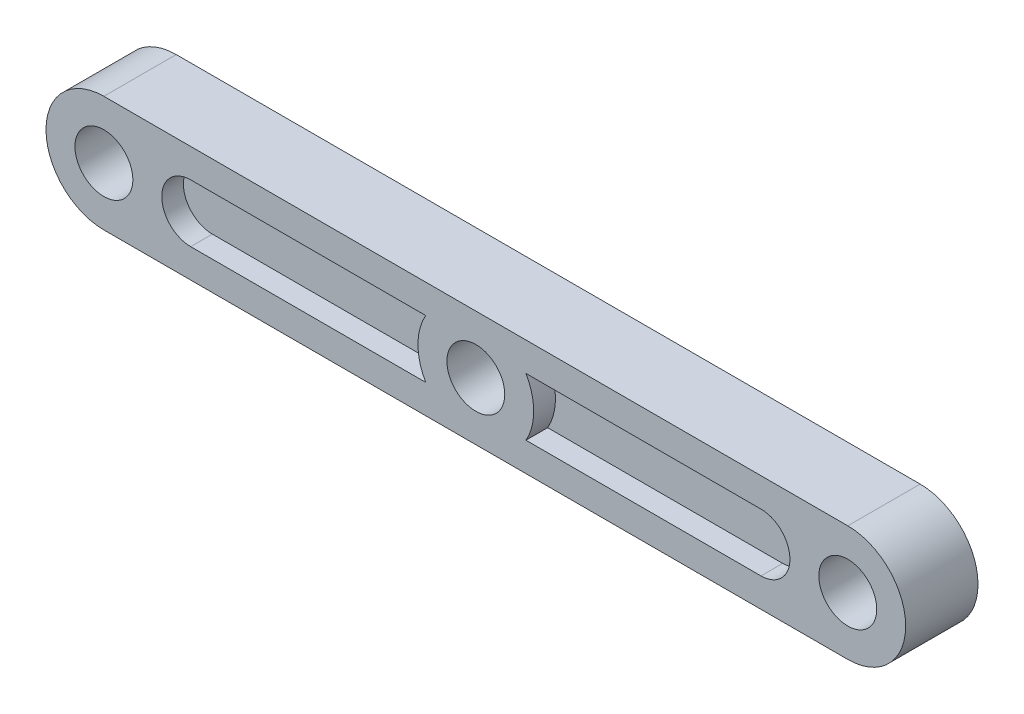
from build123d import *

# Parameters (mm, degrees)
BOSS_EXTRUDE1_DEPTH      = 5
CUT_EXTRUDE1_DEPTH       = 1.5
CUT_EXTRUDE2_DEPTH       = 1.5
F_4_0_4_DIAMETER_HOLE1_D = 4
BOSS_EXTRUDE2_START      = -5
SKETCH6_R                = 4
BOSS_EXTRUDE2_DEPTH      = 5
SKETCH7_R                = 2
CUT_EXTRUDE3_DEPTH       = 56.788378253


with BuildPart() as part:
    # Sketch1 → Boss-Extrude1 (new body)
    with BuildSketch(Plane(origin=(0, 0, 0), x_dir=(-1, 0, 0), z_dir=(0, 0, -1))):
        with BuildLine():
            Line((0, 4), (-51.4197, 4))
            ThreePointArc((-51.4197, 4), (-55.4197, 0), (-51.4197, -4))
            Line((-51.4197, -4), (0, -4))
            ThreePointArc((0, -4), (4, 0), (0, 4))
        make_face()
    extrude(amount=-BOSS_EXTRUDE1_DEPTH)

    # Sketch2 → Cut-Extrude1 (cut)
    with BuildSketch(Plane(origin=(0, 0, 0), x_dir=(-1, 0, 0), z_dir=(0, 0, -1))):
        with BuildLine():
            Line((-6, 2.5), (-45.4197, 2.5))
            ThreePointArc((-45.4197, 2.5), (-47.9197, 0), (-45.4197, -2.5))
            Line((-45.4197, -2.5), (-6, -2.5))
            ThreePointArc((-6, -2.5), (-3.5, 0), (-6, 2.5))
        make_face()
    extrude(amount=-CUT_EXTRUDE1_DEPTH, mode=Mode.SUBTRACT)

    # Sketch3 → Cut-Extrude2 (cut)
    with BuildSketch(Plane.XY.offset(5)):
        with BuildLine():
            Line((6, -2), (45.4197, -2))
            ThreePointArc((45.4197, -2), (47.4197, 0), (45.4197, 2))
            Line((45.4197, 2), (6, 2))
            ThreePointArc((6, 2), (4, 0), (6, -2))
        make_face()
    extrude(amount=-CUT_EXTRUDE2_DEPTH, mode=Mode.SUBTRACT)

    # Ø4.0 (4) Diameter Hole1 (through all)
    with Locations(Plane(origin=(0, 0, 0), x_dir=(-1, 0, 0), z_dir=(0, 0, -1))):
        with Locations((-51.4197, 0), (0, 0)):
            Hole(F_4_0_4_DIAMETER_HOLE1_D / 2)

    # Sketch6 → Boss-Extrude2 (add)
    with BuildSketch(Plane.XY.offset(5).offset(BOSS_EXTRUDE2_START)):
        with Locations((25.70985, 0)):
            Circle(SKETCH6_R)
    extrude(amount=BOSS_EXTRUDE2_DEPTH)

    # Sketch7 → Cut-Extrude3 (cut, through all)
    with BuildSketch(Plane.XY.offset(5)):
        with Locations((25.70985, 0)):
            Circle(SKETCH7_R)
    extrude(amount=-CUT_EXTRUDE3_DEPTH, mode=Mode.SUBTRACT)


solid = part.part
